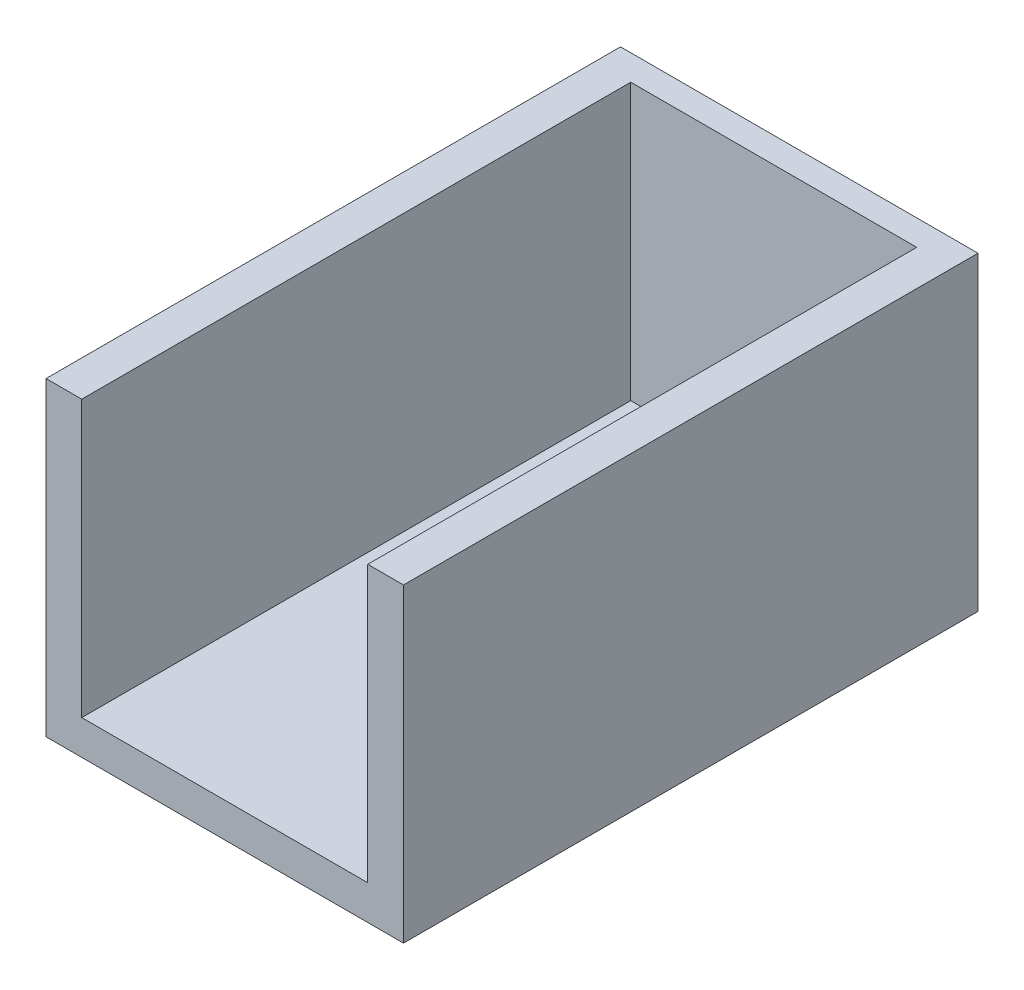
from build123d import *

# Parameters (mm, degrees)
SKETCH1_W           = 28
SKETCH1_H           = 27
BOSS_EXTRUDE1_DEPTH = 45
SKETCH2_W           = 22.4
SKETCH2_H           = 21.6
CUT_EXTRUDE1_DEPTH  = 43
FILLET3_R           = 2
SKETCH12_W          = 28
SKETCH12_H          = 3.238807787
CUT_EXTRUDE9_DEPTH  = 50.022953807


with BuildPart() as part:
    # Sketch1 → Boss-Extrude1 (new body)
    with BuildSketch(Plane.XY):
        Rectangle(SKETCH1_W, SKETCH1_H)
    extrude(amount=BOSS_EXTRUDE1_DEPTH)

    # Sketch2 → Cut-Extrude1 (cut)
    with BuildSketch(Plane.XY.offset(45)):
        Rectangle(SKETCH2_W, SKETCH2_H)
    extrude(amount=-CUT_EXTRUDE1_DEPTH, mode=Mode.SUBTRACT)

    # Fillet3
    fillet3_edges = [part.edges().sort_by_distance(p)[0] for p in [
        (-14, 13.5, 22.5),
        (14, 13.5, 22.5),
    ]]
    fillet(fillet3_edges, radius=FILLET3_R)

    # Sketch12 → Cut-Extrude9 (cut, through all)
    with BuildSketch(Plane.XY.offset(45)):
        with Locations((0, 12.419403894)):
            Rectangle(SKETCH12_W, SKETCH12_H)
    extrude(amount=-CUT_EXTRUDE9_DEPTH, mode=Mode.SUBTRACT)


solid = part.part
